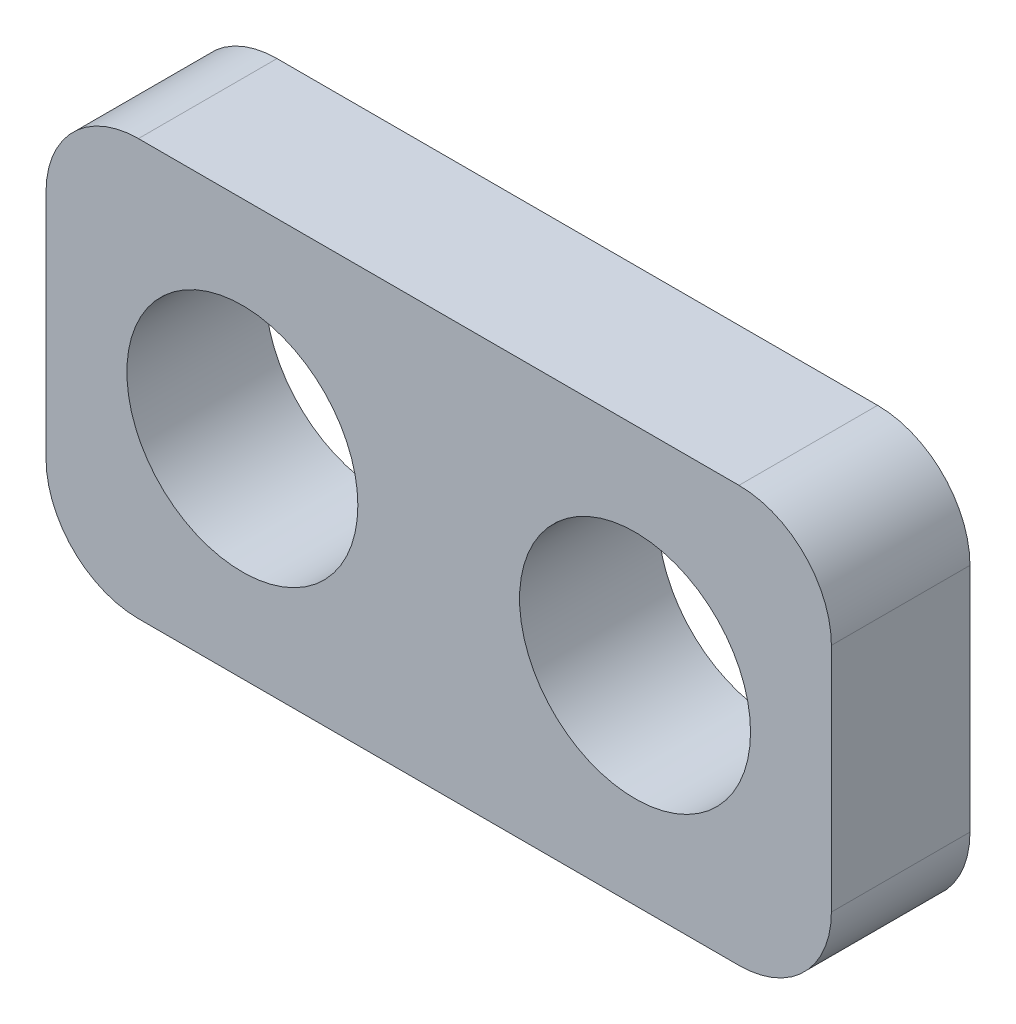
from build123d import *

# Parameters (mm, degrees)
SKETCH1_R           = 2.5
BOSS_EXTRUDE1_DEPTH = 3


with BuildPart() as part:
    # Sketch1 → Boss-Extrude1 (new body)
    with BuildSketch(Plane.XY):
        with BuildLine():
            Line((-6.5, -4.5), (6.5, -4.5))
            ThreePointArc((6.5, -4.5), (7.914213562, -3.914213562), (8.5, -2.5))
            Line((8.5, -2.5), (8.5, 2.5))
            ThreePointArc((8.5, 2.5), (7.914213562, 3.914213562), (6.5, 4.5))
            Line((6.5, 4.5), (-6.5, 4.5))
            ThreePointArc((-6.5, 4.5), (-7.914213562, 3.914213562), (-8.5, 2.5))
            Line((-8.5, 2.5), (-8.5, -2.5))
            ThreePointArc((-8.5, -2.5), (-7.914213562, -3.914213562), (-6.5, -4.5))
        make_face()
        with Locations((-4.25, 0)):
            Circle(SKETCH1_R, mode=Mode.SUBTRACT)
        with Locations((4.25, 0)):
            Circle(SKETCH1_R, mode=Mode.SUBTRACT)
    extrude(amount=BOSS_EXTRUDE1_DEPTH)


solid = part.part
